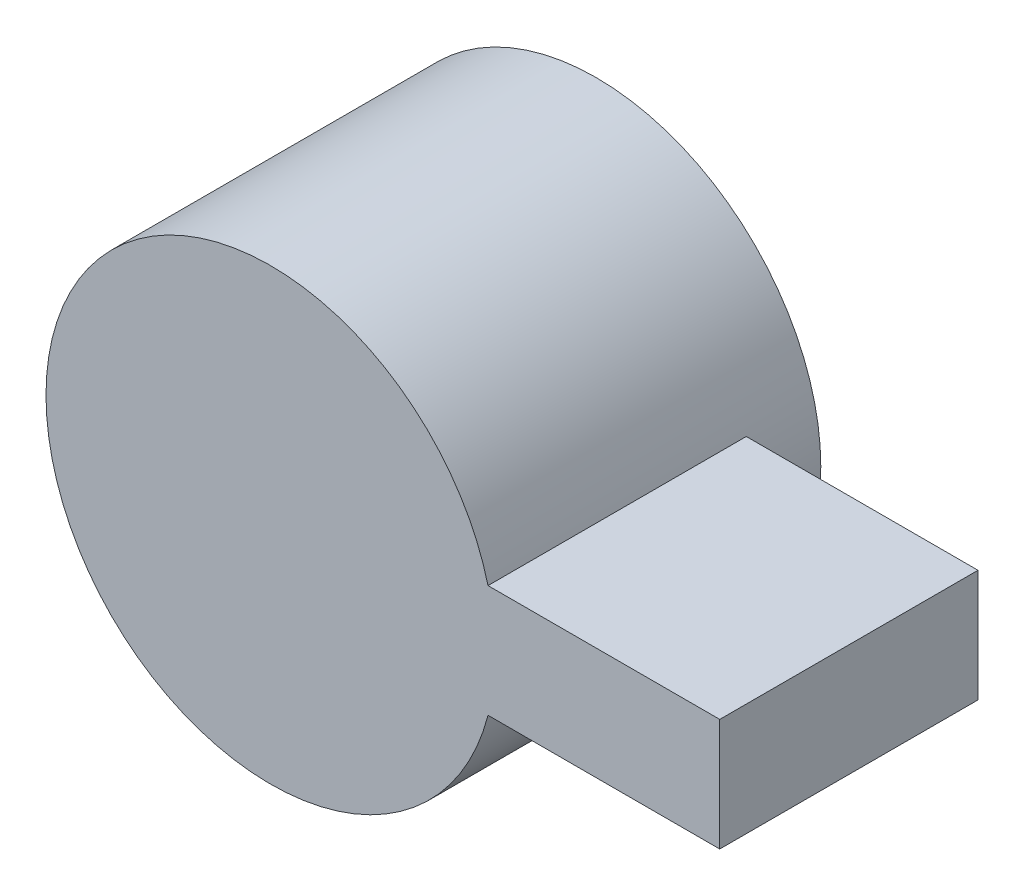
from build123d import *

# Parameters (mm, degrees)
DODANIE_WYCI_GNI_CIE3_DEPTH = 11.5
WYTNIJ_WYCI_GNI_CIE1_DEPTH  = 10
DODANIE_WYCI_GNI_CIE4_START = 3
DODANIE_WYCI_GNI_CIE4_DEPTH = 3


with BuildPart() as part:
    # Szkic1 → Dodanie-wyciągnięcie3 (new body)
    with BuildSketch(Plane.XY):
        with BuildLine():
            ThreePointArc((9.682458366, 2.5), (-10, 0), (9.682458366, -2.5))
            Line((9.682458366, -2.5), (20, -2.5))
            Line((20, -2.5), (20, 2.5))
            Line((20, 2.5), (9.682458366, 2.5))
        make_face()
    extrude(amount=DODANIE_WYCI_GNI_CIE3_DEPTH)

    # Szkic1<6> → Wytnij-wyciągnięcie1 (cut)
    with BuildSketch(Plane.XY):
        with BuildLine():
            Line((1.55, -2.626785107), (1.55, 2.626785107))
            ThreePointArc((1.55, 2.626785107), (-3.05, 0), (1.55, -2.626785107))
        make_face()
    extrude(amount=WYTNIJ_WYCI_GNI_CIE1_DEPTH, mode=Mode.SUBTRACT)

    # Szkic2 → Dodanie-wyciągnięcie4 (add)
    with BuildSketch(Plane(origin=(0, 0, 0), x_dir=(-1, 0, 0), z_dir=(0, 0, -1)).offset(DODANIE_WYCI_GNI_CIE4_START)):
        with BuildLine():
            ThreePointArc((-9.682458366, -2.5), (1.260042925, -9.920296963), (10, 0))
            ThreePointArc((10, 0), (1.260042925, 9.920296963), (-9.682458366, 2.5))
            ThreePointArc((-9.682458366, 2.5), (-10, 0), (-9.682458366, -2.5))
        make_face()
        with BuildLine():
            ThreePointArc((-1.55, -2.626785107), (-3.05, 0), (-1.55, 2.626785107))
            ThreePointArc((-1.55, 2.626785107), (1.512448346, 2.648584528), (3.05, 0))
            ThreePointArc((3.05, 0), (1.512448346, -2.648584528), (-1.55, -2.626785107))
        make_face(mode=Mode.SUBTRACT)
    extrude(amount=-DODANIE_WYCI_GNI_CIE4_DEPTH)


solid = part.part
